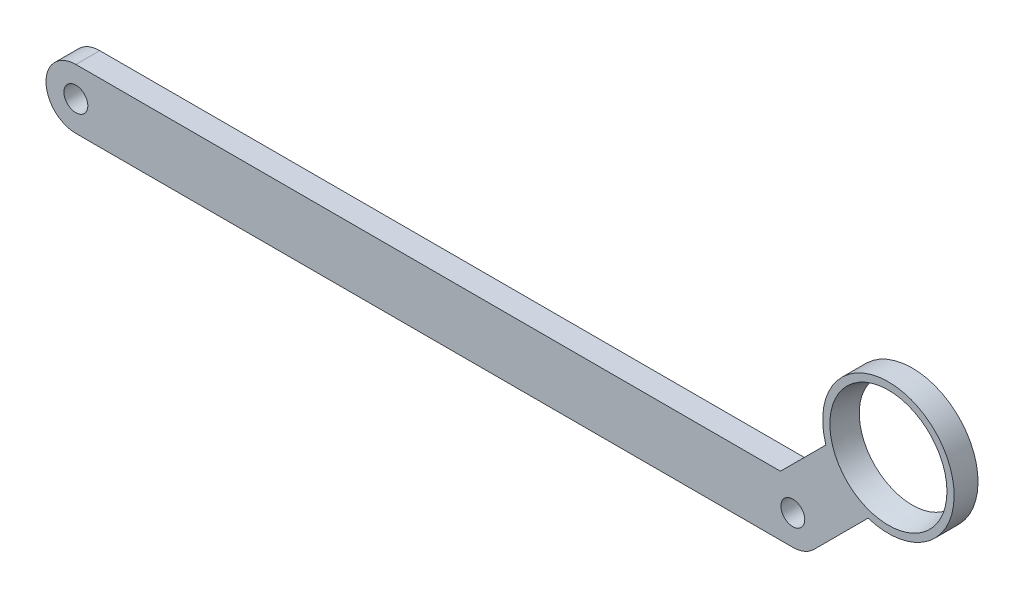
from build123d import *

# Parameters (mm, degrees)
SKETCH1_R           = 2
SKETCH1_R_2         = 8.8
BOSS_EXTRUDE1_DEPTH = 4
SKETCH2_R           = 9.8
CUT_EXTRUDE2_DEPTH  = 4
CUT_EXTRUDE2_DRAFT  = -13


with BuildPart() as part:
    # Sketch1 → Boss-Extrude1 (new body)
    with BuildSketch(Plane.XY):
        with BuildLine():
            ThreePointArc((75, -5), (76.913417162, -4.619397663), (78.535533906, -3.535533906))
            Line((78.535533906, -3.535533906), (87.607330676, 5.536262864))
            ThreePointArc((87.607330676, 5.536262864), (98.778174593, 23.778174593), (80.536262864, 12.607330676))
            Line((80.536262864, 12.607330676), (72.928932188, 5))
            Line((72.928932188, 5), (-45, 5))
            ThreePointArc((-45, 5), (-50, 0), (-45, -5))
            Line((-45, -5), (75, -5))
        make_face()
        with Locations((-45, 0)):
            Circle(SKETCH1_R, mode=Mode.SUBTRACT)
        with Locations((75, 0)):
            Circle(SKETCH1_R, mode=Mode.SUBTRACT)
        with Locations((91, 16)):
            Circle(SKETCH1_R_2, mode=Mode.SUBTRACT)
    extrude(amount=BOSS_EXTRUDE1_DEPTH)


with BuildPart() as cut_extrude2_tool:
    # Sketch2 → Cut-Extrude2 (with draft: the straight prism first)
    with BuildSketch(Plane.XY.offset(4)):
        with Locations((91, 16)):
            Circle(SKETCH2_R)
    extrude(amount=-CUT_EXTRUDE2_DEPTH)
    # Cut-Extrude2: the draft: its side faces are tilted about the plane it starts from
    cut_extrude2_sides = [cut_extrude2_tool.faces().sort_by_distance(p)[0] for p in [
        (81.2, 16, 2),
    ]]
    draft(cut_extrude2_sides, Plane.XY.offset(4), CUT_EXTRUDE2_DRAFT)


with BuildPart() as part_1:
    add(part.part)

    # Cut-Extrude2: cut by cut_extrude2_tool
    add(cut_extrude2_tool.part, mode=Mode.SUBTRACT)


solid = part_1.part
